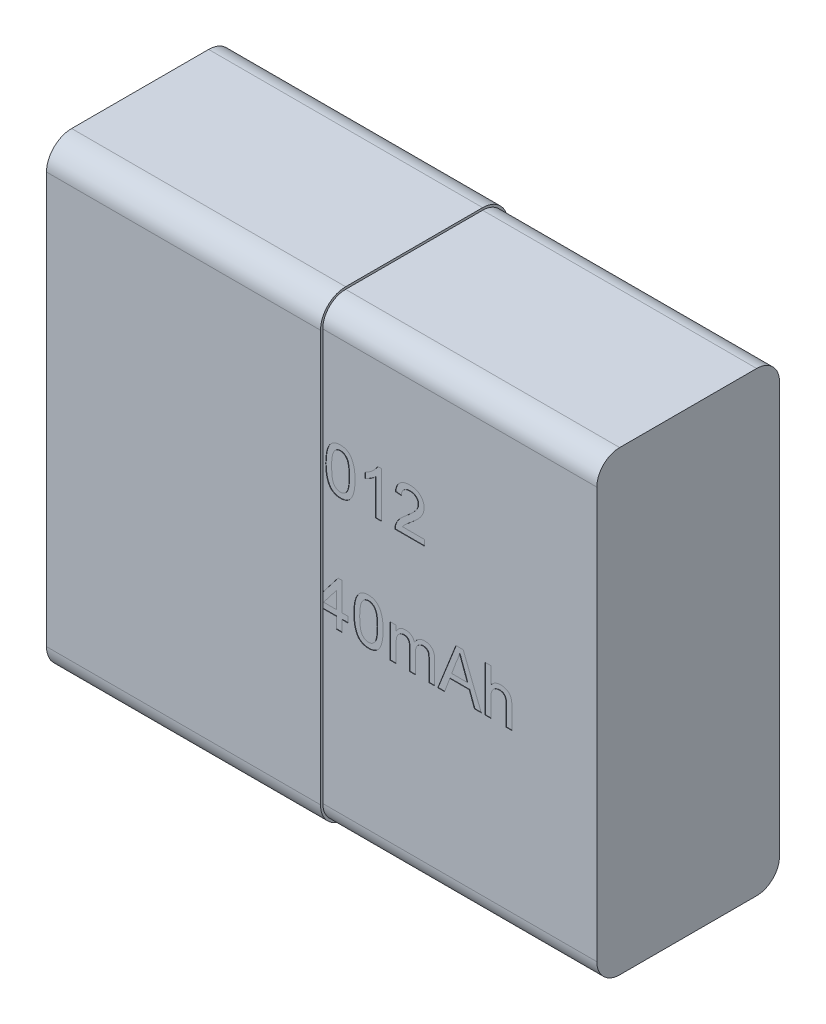
from build123d import *

# Parameters (mm, degrees)
SKETCH1_W           = 12
SKETCH1_H           = 10
BOSS_EXTRUDE1_DEPTH = 4
FILLET1_R           = 0.5
BOSS_EXTRUDE2_DEPTH = 6
SKETCH5_W           = 0.128205128
SKETCH5_H           = 0.128205129
SKETCH5_W_2         = 0.371794872
SKETCH5_H_2         = 0.115384616
CUT_EXTRUDE1_DEPTH  = 0.01


with BuildPart() as part:
    # Sketch1 → Boss-Extrude1 (new body)
    with BuildSketch(Plane.XY):
        Rectangle(SKETCH1_W, SKETCH1_H)
    extrude(amount=BOSS_EXTRUDE1_DEPTH)

    # Fillet1
    fillet1_edges = [part.edges().sort_by_distance(p)[0] for p in [
        (0, 5, 4),
        (0, 5, 0),
        (0, -5, 0),
        (0, -5, 4),
    ]]
    fillet(fillet1_edges, radius=FILLET1_R)

    # Sketch5 → Cut-Extrude1 (cut)
    # profile 1 of 16: a face of its own
    with BuildSketch(Plane.XY.offset(4)):
        with BuildLine():
            Line((-2.243589744, 1.762048705), (-2.115384615, 1.774869218))
            add(Edge.make_bspline(
                [(-2.115384615, 1.774869218), (-2.113675487, 1.767165894), (-2.110368452, 1.752260535), (-2.104005311, 1.730907059), (-2.097284437, 1.711086259), (-2.088952609, 1.693241478), (-2.080822556, 1.676642938), (-2.071268512, 1.661976476), (-2.061059831, 1.648859423), (-2.050007788, 1.637340487), (-2.037985028, 1.627421277), (-2.025151842, 1.618741433), (-2.011236819, 1.611492594), (-1.996346496, 1.605753281), (-1.980606285, 1.601107257), (-1.963930646, 1.597695767), (-1.946231402, 1.5956635), (-1.934100007, 1.59547739), (-1.927884615, 1.595382038)],
                knots=[0, 0, 0, 0, 1.321063709, 2.556160278, 3.730472002, 4.821700466, 5.852032229, 6.822994757, 7.746964065, 8.632786469, 9.490489437, 10.352773447, 11.223141997, 12.11199479, 13.021433979, 13.96892724, 14.959401504, 16, 16, 16, 16], degree=3))
            add(Edge.make_bspline(
                [(-1.927884615, 1.595382038), (-1.920594182, 1.595485982), (-1.906355954, 1.595688985), (-1.885608506, 1.5987348), (-1.865863651, 1.602916995), (-1.847403096, 1.609474915), (-1.829969786, 1.617489905), (-1.813663041, 1.627394734), (-1.798371242, 1.639025481), (-1.784396009, 1.65246126), (-1.771897992, 1.667241046), (-1.760766753, 1.682852271), (-1.751562713, 1.699428143), (-1.743805094, 1.716735184), (-1.738078956, 1.735053069), (-1.733886961, 1.754153383), (-1.73114747, 1.774122505), (-1.730897041, 1.787747329), (-1.730769231, 1.794700949)],
                knots=[0, 0, 0, 0, 1.111377895, 2.170522867, 3.193923215, 4.186422864, 5.152846954, 6.117443035, 7.091571248, 8.078879332, 9.069127402, 10.041602243, 10.999610288, 11.957618333, 12.930786866, 13.922135183, 14.939532534, 16, 16, 16, 16], degree=3))
            add(Edge.make_bspline(
                [(-1.730769231, 1.794700949), (-1.730919445, 1.80131838), (-1.731213328, 1.814264857), (-1.733629282, 1.833267507), (-1.737845069, 1.851306147), (-1.743689158, 1.868485174), (-1.751156703, 1.884779367), (-1.760132473, 1.900323465), (-1.771110575, 1.914776817), (-1.783467397, 1.928294665), (-1.796945085, 1.940748481), (-1.811694344, 1.951342055), (-1.827216108, 1.960484655), (-1.84369536, 1.967866946), (-1.861063678, 1.973726313), (-1.879304506, 1.977937555), (-1.89850554, 1.980354558), (-1.911585045, 1.980648492), (-1.918269231, 1.980798705)],
                knots=[0, 0, 0, 0, 1.072815875, 2.098878726, 3.09954706, 4.07199174, 5.036203424, 6.001873089, 6.97636515, 7.972747947, 8.969130744, 9.945905975, 10.911575641, 11.885646534, 12.868345115, 13.879560892, 14.916365174, 16, 16, 16, 16], degree=3))
            add(Edge.make_bspline(
                [(-1.918269231, 1.980798705), (-1.92415425, 1.980642792), (-1.936643633, 1.980311909), (-1.956356058, 1.977390337), (-1.978190909, 1.97329945), (-1.993279413, 1.969284852), (-2.001201923, 1.96717691)],
                knots=[0, 0, 0, 0, 0.837610211, 1.777604146, 2.833088267, 4, 4, 4, 4], degree=3))
            Line((-2.001201923, 1.96717691), (-1.987980769, 2.082561526))
            add(Edge.make_bspline(
                [(-1.987980769, 2.082561526), (-1.984511848, 2.082182467), (-1.978383457, 2.081512802), (-1.972224162, 2.081266268), (-1.969551282, 2.081159282)],
                knots=[0, 0, 0, 0, 1.132082448, 2, 2, 2, 2], degree=3))
            add(Edge.make_bspline(
                [(-1.969551282, 2.081159282), (-1.957760656, 2.081609443), (-1.934631153, 2.082492519), (-1.900912822, 2.089830137), (-1.868957734, 2.101382979), (-1.844270364, 2.115167196), (-1.825963045, 2.128132001), (-1.814418817, 2.139821611), (-1.8040111, 2.152226649), (-1.796246093, 2.166455677), (-1.789537606, 2.181574363), (-1.78538339, 2.198178273), (-1.782353796, 2.215863807), (-1.782153931, 2.228113288), (-1.782051282, 2.234404474)],
                knots=[0, 0, 0, 0, 1.557468908, 3.055264441, 4.54122591, 6.035034992, 6.780215604, 7.498173296, 8.201377046, 8.913174237, 9.633083494, 10.382644491, 11.169345745, 12, 12, 12, 12], degree=3))
            add(Edge.make_bspline(
                [(-1.782051282, 2.234404474), (-1.782146019, 2.239486077), (-1.782331298, 2.249424259), (-1.784395392, 2.263994683), (-1.78780915, 2.277800608), (-1.792423183, 2.290989444), (-1.798470331, 2.30349207), (-1.80596927, 2.31529318), (-1.814537062, 2.32663217), (-1.824651037, 2.336923115), (-1.835482227, 2.346584783), (-1.847425601, 2.35472189), (-1.859912742, 2.361950512), (-1.873384046, 2.367412845), (-1.887506937, 2.371903774), (-1.902402138, 2.375050834), (-1.918075087, 2.377164296), (-1.928812184, 2.377342384), (-1.934294872, 2.37743332)],
                knots=[0, 0, 0, 0, 1.041493611, 2.036867705, 3.009952345, 3.954088258, 4.897230656, 5.850851638, 6.817653571, 7.805463921, 8.805067469, 9.788883576, 10.763797054, 11.758134544, 12.762883247, 13.799594994, 14.876406454, 16, 16, 16, 16], degree=3))
            add(Edge.make_bspline(
                [(-1.934294872, 2.37743332), (-1.945024353, 2.37701496), (-1.96574457, 2.376207045), (-1.995410033, 2.368732151), (-2.022292298, 2.3566368), (-2.042194631, 2.34245233), (-2.056327037, 2.328891175), (-2.065980219, 2.317396532), (-2.074614444, 2.304703093), (-2.082254182, 2.290815385), (-2.088796217, 2.275677554), (-2.094693681, 2.259477137), (-2.099258865, 2.241954764), (-2.10144368, 2.229813487), (-2.102564103, 2.223587167)],
                knots=[0, 0, 0, 0, 1.533565899, 2.961543033, 4.347411787, 5.731829577, 6.434842101, 7.147085226, 7.87612511, 8.629021686, 9.412189982, 10.234506416, 11.094615066, 12, 12, 12, 12], degree=3))
            Line((-2.102564103, 2.223587167), (-2.230769231, 2.236407679))
            add(Edge.make_bspline(
                [(-2.230769231, 2.236407679), (-2.22876372, 2.246320639), (-2.224829752, 2.265765691), (-2.21681498, 2.293849644), (-2.207041063, 2.320212478), (-2.195305834, 2.344733326), (-2.182163702, 2.367705643), (-2.167003299, 2.388856943), (-2.150180061, 2.408312973), (-2.131664106, 2.426014389), (-2.111706798, 2.441823733), (-2.090408658, 2.455461366), (-2.06794447, 2.467021226), (-2.044293203, 2.476340519), (-2.019473584, 2.483918515), (-1.993415, 2.488938957), (-1.966235403, 2.492335033), (-1.947727205, 2.492654988), (-1.938301282, 2.492817936)],
                knots=[0, 0, 0, 0, 1.136581168, 2.229493434, 3.279335563, 4.293305329, 5.282068175, 6.250623624, 7.213783178, 8.169396253, 9.125981663, 10.071280146, 11.007896369, 11.961295906, 12.925420184, 13.920544621, 14.940967302, 16, 16, 16, 16], degree=3))
            add(Edge.make_bspline(
                [(-1.938301282, 2.492817936), (-1.92525356, 2.49239483), (-1.899597521, 2.491562868), (-1.861914779, 2.484955324), (-1.825871434, 2.474112211), (-1.791757525, 2.459081724), (-1.760159964, 2.440714865), (-1.732198727, 2.418703303), (-1.708247618, 2.393427834), (-1.688771834, 2.365164791), (-1.673349745, 2.335073096), (-1.661937863, 2.303836611), (-1.655119092, 2.271491296), (-1.654271329, 2.249593525), (-1.653846154, 2.238611205)],
                knots=[0, 0, 0, 0, 1.104647871, 2.172094857, 3.229560912, 4.285649672, 5.322588163, 6.317201348, 7.289435229, 8.260615662, 9.214246199, 10.146367077, 11.070353327, 12, 12, 12, 12], degree=3))
            add(Edge.make_bspline(
                [(-1.653846154, 2.238611205), (-1.654277197, 2.228229652), (-1.655128271, 2.207731772), (-1.661680533, 2.177760241), (-1.672752552, 2.149365586), (-1.687717765, 2.122448182), (-1.707123975, 2.09759014), (-1.730917877, 2.07543936), (-1.758718834, 2.05578389), (-1.779553299, 2.045553435), (-1.790264423, 2.040293897)],
                knots=[0, 0, 0, 0, 0.975609618, 1.926294443, 2.868398979, 3.832526731, 4.812148358, 5.820404151, 6.879456693, 8, 8, 8, 8], degree=3))
            add(Edge.make_bspline(
                [(-1.790264423, 2.040293897), (-1.783083329, 2.038480813), (-1.769017663, 2.034929511), (-1.748816175, 2.027571312), (-1.729824509, 2.018956712), (-1.711789898, 2.009199664), (-1.695235919, 1.997660374), (-1.679591973, 1.985043468), (-1.665449436, 1.970741307), (-1.652398574, 1.955263646), (-1.640523892, 1.938772462), (-1.630531231, 1.920946963), (-1.621907855, 1.90225575), (-1.614554659, 1.882563258), (-1.60927067, 1.861717641), (-1.60549245, 1.839880391), (-1.602999133, 1.817127378), (-1.602710534, 1.801585231), (-1.602564103, 1.793699346)],
                knots=[0, 0, 0, 0, 1.053251915, 2.063013066, 3.05373318, 4.018979697, 4.975584284, 5.920798056, 6.874756953, 7.832116109, 8.799604348, 9.761196922, 10.734637845, 11.72654167, 12.747371341, 13.789206138, 14.878271633, 16, 16, 16, 16], degree=3))
            add(Edge.make_bspline(
                [(-1.602564103, 1.793699346), (-1.60280811, 1.782933216), (-1.603287664, 1.761774315), (-1.60783385, 1.730691407), (-1.615263338, 1.700909804), (-1.625544753, 1.67232837), (-1.638572933, 1.644830462), (-1.65492115, 1.61880412), (-1.674104879, 1.594037787), (-1.695824211, 1.57076859), (-1.719619818, 1.549383482), (-1.745460937, 1.530866023), (-1.772836303, 1.515140705), (-1.801790465, 1.502316786), (-1.832246666, 1.49224162), (-1.864235205, 1.485019419), (-1.897855068, 1.480774857), (-1.920794406, 1.480259978), (-1.932491987, 1.479997423)],
                knots=[0, 0, 0, 0, 1.016055063, 1.996874249, 2.958724482, 3.910019225, 4.860394196, 5.826121543, 6.806008102, 7.814207964, 8.82789325, 9.821757317, 10.810247154, 11.803791187, 12.806673825, 13.834534493, 14.895752369, 16, 16, 16, 16], degree=3))
            add(Edge.make_bspline(
                [(-1.932491987, 1.479997423), (-1.942989596, 1.480195155), (-1.96365582, 1.480584423), (-1.993906905, 1.484639929), (-2.022889018, 1.490395159), (-2.050372983, 1.499267537), (-2.076678051, 1.510087258), (-2.10135871, 1.523929459), (-2.124858737, 1.539819769), (-2.146736949, 1.55821218), (-2.166871843, 1.578512593), (-2.184834577, 1.600420749), (-2.200259299, 1.623888004), (-2.213859215, 1.648563245), (-2.224851465, 1.674911611), (-2.233410671, 1.702706884), (-2.239937181, 1.731845909), (-2.242358976, 1.751871565), (-2.243589744, 1.762048705)],
                knots=[0, 0, 0, 0, 1.08471039, 2.135426191, 3.150939737, 4.135689946, 5.116584603, 6.086901885, 7.055842759, 8.045878862, 9.036901429, 10.008421467, 10.96965771, 11.936653536, 12.917548193, 13.915472582, 14.940632654, 16, 16, 16, 16], degree=3))
        make_face()
    # profile 2 of 16: a face of its own
    with BuildSketch(Plane.XY.offset(4)):
        with BuildLine():
            add(Edge.make_bspline(
                [(-1.474358974, 1.986007038), (-1.474229808, 2.000297956), (-1.473976825, 2.028287846), (-1.472407652, 2.069242084), (-1.469668004, 2.108134627), (-1.465578464, 2.144931701), (-1.460735683, 2.179716362), (-1.454440036, 2.21243897), (-1.447356519, 2.243172943), (-1.438857569, 2.271886246), (-1.429520005, 2.298825761), (-1.418926242, 2.32394827), (-1.40700682, 2.34722714), (-1.394347507, 2.368903783), (-1.380281889, 2.388641039), (-1.365658939, 2.406992817), (-1.349415949, 2.423286085), (-1.332228337, 2.43794007), (-1.31384301, 2.450871357), (-1.294357246, 2.462029499), (-1.273846021, 2.471881334), (-1.251918413, 2.479297792), (-1.229029634, 2.485343778), (-1.2050035, 2.489791278), (-1.179813533, 2.49241323), (-1.162599732, 2.49268151), (-1.153846154, 2.492817936)],
                knots=[0, 0, 0, 0, 1.514747001, 2.966751498, 4.343369068, 5.64627492, 6.890416844, 8.064737671, 9.177176366, 10.232018008, 11.237056675, 12.19799043, 13.119080079, 14.007588942, 14.855863561, 15.685992447, 16.491747269, 17.290132607, 18.077525251, 18.870243746, 19.668095604, 20.485086593, 21.319398728, 22.175900658, 23.072407314, 24, 24, 24, 24], degree=3))
            add(Edge.make_bspline(
                [(-1.153846154, 2.492817936), (-1.141003516, 2.492440371), (-1.115773639, 2.491698631), (-1.078937889, 2.48564913), (-1.044222568, 2.475300526), (-1.011650231, 2.461339812), (-0.981777698, 2.443607019), (-0.955100266, 2.422050108), (-0.931905696, 2.396895421), (-0.912447119, 2.367844885), (-0.895438381, 2.335699906), (-0.880328192, 2.300316206), (-0.866669019, 2.261733438), (-0.856976173, 2.227196473), (-0.850062274, 2.19738294), (-0.845485822, 2.172793581), (-0.84168645, 2.146261525), (-0.838775617, 2.117850959), (-0.836387347, 2.087593748), (-0.834542996, 2.055471054), (-0.833606799, 2.021402592), (-0.833426197, 1.99802674), (-0.833333333, 1.986007038)],
                knots=[0, 0, 0, 0, 1.134486744, 2.228744715, 3.287356444, 4.328707449, 5.352829806, 6.347195599, 7.349461267, 8.364207941, 9.428085653, 10.559314403, 11.761222316, 13.04268526, 13.726896727, 14.465273606, 15.252205015, 16.094778733, 16.988606776, 17.934225168, 18.937792761, 20, 20, 20, 20], degree=3))
            add(Edge.make_bspline(
                [(-0.833333333, 1.986007038), (-0.83346492, 1.971783247), (-0.833721999, 1.943994271), (-0.835249125, 1.903368417), (-0.838153856, 1.864769299), (-0.84172818, 1.828108497), (-0.847135384, 1.793483877), (-0.852961939, 1.76074833), (-0.860167949, 1.730050503), (-0.86857567, 1.701376943), (-0.878044674, 1.674576033), (-0.888428901, 1.649445227), (-0.89993043, 1.626001699), (-0.91289159, 1.604474103), (-0.926719348, 1.584576698), (-0.941514979, 1.566234843), (-0.957592167, 1.549712531), (-0.974934666, 1.5351025), (-0.993190905, 1.521941895), (-1.012724042, 1.510673588), (-1.033448585, 1.501337992), (-1.055226065, 1.493356522), (-1.078277446, 1.487508168), (-1.102420946, 1.483031345), (-1.127745524, 1.480395067), (-1.145025907, 1.4801318), (-1.153846154, 1.479997423)],
                knots=[0, 0, 0, 0, 1.508974709, 2.94807912, 4.311757619, 5.615040294, 6.854280449, 8.028314546, 9.141715822, 10.197470207, 11.196696834, 12.155719058, 13.080757287, 13.963948316, 14.818758719, 15.649605906, 16.461113142, 17.260189315, 18.052359509, 18.845763934, 19.647754795, 20.461145776, 21.303032214, 22.167241874, 23.064524267, 24, 24, 24, 24], degree=3))
            add(Edge.make_bspline(
                [(-1.153846154, 1.479997423), (-1.16541052, 1.480327297), (-1.187957851, 1.480970461), (-1.220886565, 1.485340363), (-1.25179192, 1.493031595), (-1.280934584, 1.503346623), (-1.307986986, 1.517143566), (-1.33307829, 1.533930241), (-1.356712689, 1.553316089), (-1.370318085, 1.568611078), (-1.377203526, 1.57635159)],
                knots=[0, 0, 0, 0, 1.10322584, 2.150986741, 3.161425019, 4.136713905, 5.093944212, 6.049774532, 7.013026876, 8, 8, 8, 8], degree=3))
            add(Edge.make_bspline(
                [(-1.377203526, 1.57635159), (-1.385128826, 1.587783951), (-1.401471134, 1.61135797), (-1.420598388, 1.651553859), (-1.437660238, 1.695803889), (-1.451050661, 1.744976241), (-1.461538701, 1.798679558), (-1.469113684, 1.857019217), (-1.473400379, 1.919970015), (-1.474032229, 1.963497781), (-1.474358974, 1.986007038)],
                knots=[0, 0, 0, 0, 0.779365345, 1.607084704, 2.489375761, 3.438383567, 4.461919411, 5.557722155, 6.737039282, 8, 8, 8, 8], degree=3))
        make_face()
        with BuildLine():
            add(Edge.make_bspline(
                [(-1.346153846, 1.986407679), (-1.346026549, 1.967174042), (-1.345782873, 1.930356606), (-1.343237055, 1.877756547), (-1.338854534, 1.830304113), (-1.333060554, 1.788065007), (-1.325410156, 1.75098209), (-1.315804176, 1.719149863), (-1.304975951, 1.692186265), (-1.291576228, 1.67042549), (-1.276905012, 1.652687284), (-1.261757984, 1.637431853), (-1.245778787, 1.624465087), (-1.229071683, 1.613653447), (-1.21137745, 1.605467585), (-1.19288957, 1.599534453), (-1.173604022, 1.596120027), (-1.160469687, 1.595629438), (-1.153846154, 1.595382038)],
                knots=[0, 0, 0, 0, 1.89448813, 3.626469325, 5.185477471, 6.587276848, 7.82441448, 8.910550357, 9.859733512, 10.6775885, 11.416198291, 12.123144072, 12.791880183, 13.439617036, 14.078171869, 14.70637855, 15.347637704, 16, 16, 16, 16], degree=3))
            add(Edge.make_bspline(
                [(-1.153846154, 1.595382038), (-1.147224279, 1.595634844), (-1.134093233, 1.596136152), (-1.114763124, 1.599475287), (-1.096347177, 1.605713852), (-1.078679325, 1.613870802), (-1.061850789, 1.624436012), (-1.045950071, 1.637451757), (-1.030723251, 1.652698129), (-1.016117938, 1.67064251), (-1.002820302, 1.692503892), (-0.991788953, 1.719445525), (-0.982332677, 1.7513335), (-0.974640299, 1.788397523), (-0.968822419, 1.830569847), (-0.964466395, 1.877890669), (-0.96190354, 1.930423049), (-0.961663885, 1.967173955), (-0.961538462, 1.986407679)],
                knots=[0, 0, 0, 0, 0.652509534, 1.29391342, 1.924290653, 2.562989607, 3.207355802, 3.876242846, 4.583348185, 5.32723334, 6.150888545, 7.094226006, 8.186903555, 9.424320409, 10.81992305, 12.379283064, 14.105084285, 16, 16, 16, 16], degree=3))
            add(Edge.make_bspline(
                [(-0.961538462, 1.986407679), (-0.96165987, 2.005241212), (-0.961892483, 2.041325547), (-0.964521438, 2.092912265), (-0.968641246, 2.139568229), (-0.97427649, 2.181336451), (-0.981765728, 2.218171586), (-0.990849152, 2.250152052), (-1.00167341, 2.277209644), (-1.014543414, 2.299616156), (-1.028870304, 2.317995575), (-1.043836099, 2.333904562), (-1.059814944, 2.347434637), (-1.077089938, 2.358288662), (-1.095104274, 2.367045286), (-1.114271877, 2.373071818), (-1.134404344, 2.37677433), (-1.148220994, 2.377211147), (-1.155248397, 2.37743332)],
                knots=[0, 0, 0, 0, 1.850066095, 3.544656626, 5.0727657, 6.45041401, 7.682899467, 8.762389858, 9.712573485, 10.538438529, 11.291566246, 11.996865408, 12.681389046, 13.341983376, 13.996294293, 14.643563182, 15.31009126, 16, 16, 16, 16], degree=3))
            add(Edge.make_bspline(
                [(-1.155248397, 2.37743332), (-1.161871515, 2.37725949), (-1.174931453, 2.376916718), (-1.194052914, 2.373644964), (-1.212174097, 2.368173863), (-1.229502614, 2.360762725), (-1.245605867, 2.350788796), (-1.26112247, 2.339143525), (-1.275325687, 2.324955063), (-1.283884421, 2.314347989), (-1.288261218, 2.308923705)],
                knots=[0, 0, 0, 0, 1.021318143, 2.013908504, 2.982026795, 3.937174072, 4.91255697, 5.897578595, 6.924855925, 8, 8, 8, 8], degree=3))
            add(Edge.make_bspline(
                [(-1.288261218, 2.308923705), (-1.293026215, 2.300957111), (-1.303088885, 2.284133342), (-1.314348428, 2.254892939), (-1.324294662, 2.221476724), (-1.332483711, 2.183370564), (-1.338407914, 2.140639826), (-1.343084843, 2.093334136), (-1.345514333, 2.041387447), (-1.345934794, 2.005239905), (-1.346153846, 1.986407679)],
                knots=[0, 0, 0, 0, 0.671104906, 1.417232262, 2.260109084, 3.195198885, 4.23592645, 5.382417421, 6.636286093, 8, 8, 8, 8], degree=3))
        make_face(mode=Mode.SUBTRACT)
    # profile 3 of 16: a face of its own
    with BuildSketch(Plane.XY.offset(4)):
        with BuildLine():
            Line((-0.256410256, 1.492817936), (-0.384615385, 1.492817936))
            Line((-0.384615385, 1.492817936), (-0.384615385, 2.272064731))
            add(Edge.make_bspline(
                [(-0.384615385, 2.272064731), (-0.391997447, 2.264945639), (-0.407340255, 2.250149389), (-0.433275652, 2.229208999), (-0.462222869, 2.207985026), (-0.493806008, 2.187575804), (-0.525999676, 2.168362722), (-0.557110711, 2.151083509), (-0.586619701, 2.136461102), (-0.606057432, 2.128465512), (-0.615384615, 2.124628833)],
                knots=[0, 0, 0, 0, 0.893362401, 1.856755847, 2.901947673, 4.020460078, 5.132200827, 6.168787962, 7.121294059, 8, 8, 8, 8], degree=3))
            Line((-0.615384615, 2.124628833), (-0.615384615, 2.242817936))
            add(Edge.make_bspline(
                [(-0.615384615, 2.242817936), (-0.599364215, 2.251068474), (-0.567788953, 2.267329797), (-0.523179936, 2.295415337), (-0.481532621, 2.325861219), (-0.443536434, 2.358660701), (-0.409475273, 2.39218766), (-0.380771439, 2.426017679), (-0.356753897, 2.458910694), (-0.344703841, 2.481849925), (-0.338942308, 2.492817936)],
                knots=[0, 0, 0, 0, 1.141258006, 2.249351951, 3.335817539, 4.406819942, 5.426913362, 6.360259544, 7.215985427, 8, 8, 8, 8], degree=3))
            Line((-0.338942308, 2.492817936), (-0.256410256, 2.492817936))
            Line((-0.256410256, 2.492817936), (-0.256410256, 1.492817936))
        make_face()
    # profile 4 of 16: a face of its own
    with BuildSketch(Plane.XY.offset(4)):
        with BuildLine():
            add(Edge.make_bspline(
                [(0.064102564, 1.986007038), (0.064231731, 2.000297956), (0.064484714, 2.028287846), (0.066053886, 2.069242084), (0.068793534, 2.108134627), (0.072883074, 2.144931701), (0.077725856, 2.179716362), (0.084021502, 2.21243897), (0.09110502, 2.243172943), (0.099603969, 2.271886246), (0.108941533, 2.298825761), (0.119535297, 2.32394827), (0.131454718, 2.34722714), (0.144114032, 2.368903783), (0.15817965, 2.388641039), (0.172802599, 2.406992817), (0.189045589, 2.423286085), (0.206233202, 2.43794007), (0.224618528, 2.450871357), (0.244104292, 2.462029499), (0.264615518, 2.471881334), (0.286543126, 2.479297792), (0.309431904, 2.485343778), (0.333458039, 2.489791278), (0.358648005, 2.49241323), (0.375861806, 2.49268151), (0.384615385, 2.492817936)],
                knots=[0, 0, 0, 0, 1.514747001, 2.966751498, 4.343369068, 5.64627492, 6.890416844, 8.064737671, 9.177176366, 10.232018008, 11.237056675, 12.19799043, 13.119080079, 14.007588942, 14.855863561, 15.685992447, 16.491747269, 17.290132607, 18.077525251, 18.870243746, 19.668095604, 20.485086593, 21.319398728, 22.175900658, 23.072407314, 24, 24, 24, 24], degree=3))
            add(Edge.make_bspline(
                [(0.384615385, 2.492817936), (0.397458022, 2.492440371), (0.422687899, 2.491698631), (0.45952365, 2.48564913), (0.494238971, 2.475300526), (0.526811307, 2.461339812), (0.556683841, 2.443607019), (0.583361273, 2.422050108), (0.606555843, 2.396895421), (0.626014419, 2.367844885), (0.643023157, 2.335699906), (0.658133347, 2.300316206), (0.671792519, 2.261733438), (0.681485365, 2.227196473), (0.688399264, 2.19738294), (0.692975716, 2.172793581), (0.696775089, 2.146261525), (0.699685922, 2.117850959), (0.702074191, 2.087593748), (0.703918543, 2.055471054), (0.70485474, 2.021402592), (0.705035341, 1.99802674), (0.705128205, 1.986007038)],
                knots=[0, 0, 0, 0, 1.134486744, 2.228744715, 3.287356444, 4.328707449, 5.352829806, 6.347195599, 7.349461267, 8.364207941, 9.428085653, 10.559314403, 11.761222316, 13.04268526, 13.726896727, 14.465273606, 15.252205015, 16.094778733, 16.988606776, 17.934225168, 18.937792761, 20, 20, 20, 20], degree=3))
            add(Edge.make_bspline(
                [(0.705128205, 1.986007038), (0.704996619, 1.971783247), (0.704739539, 1.943994271), (0.703212414, 1.903368417), (0.700307683, 1.864769299), (0.696733359, 1.828108497), (0.691326155, 1.793483877), (0.685499599, 1.76074833), (0.67829359, 1.730050503), (0.669885868, 1.701376943), (0.660416865, 1.674576033), (0.650032637, 1.649445227), (0.638531108, 1.626001699), (0.625569948, 1.604474103), (0.61174219, 1.584576698), (0.596946559, 1.566234843), (0.580869371, 1.549712531), (0.563526872, 1.5351025), (0.545270634, 1.521941895), (0.525737496, 1.510673588), (0.505012953, 1.501337992), (0.483235474, 1.493356522), (0.460184093, 1.487508168), (0.436040592, 1.483031345), (0.410716014, 1.480395067), (0.393435631, 1.4801318), (0.384615385, 1.479997423)],
                knots=[0, 0, 0, 0, 1.508974709, 2.94807912, 4.311757619, 5.615040294, 6.854280449, 8.028314546, 9.141715822, 10.197470207, 11.196696834, 12.155719058, 13.080757287, 13.963948316, 14.818758719, 15.649605906, 16.461113142, 17.260189315, 18.052359509, 18.845763934, 19.647754795, 20.461145776, 21.303032214, 22.167241874, 23.064524267, 24, 24, 24, 24], degree=3))
            add(Edge.make_bspline(
                [(0.384615385, 1.479997423), (0.373051019, 1.480327297), (0.350503688, 1.480970461), (0.317574973, 1.485340363), (0.286669619, 1.493031595), (0.257526955, 1.503346623), (0.230474553, 1.517143566), (0.205383248, 1.533930241), (0.18174885, 1.553316089), (0.168143453, 1.568611078), (0.161258013, 1.57635159)],
                knots=[0, 0, 0, 0, 1.10322584, 2.150986741, 3.161425019, 4.136713905, 5.093944212, 6.049774532, 7.013026876, 8, 8, 8, 8], degree=3))
            add(Edge.make_bspline(
                [(0.161258013, 1.57635159), (0.153332713, 1.587783951), (0.136990405, 1.61135797), (0.11786315, 1.651553859), (0.100801301, 1.695803889), (0.087410877, 1.744976241), (0.076922837, 1.798679558), (0.069347854, 1.857019217), (0.065061159, 1.919970015), (0.064429309, 1.963497781), (0.064102564, 1.986007038)],
                knots=[0, 0, 0, 0, 0.779365345, 1.607084704, 2.489375761, 3.438383567, 4.461919411, 5.557722155, 6.737039282, 8, 8, 8, 8], degree=3))
        make_face()
        with BuildLine():
            add(Edge.make_bspline(
                [(0.192307692, 1.986407679), (0.19243499, 1.967174042), (0.192678665, 1.930356606), (0.195224484, 1.877756547), (0.199607005, 1.830304113), (0.205400984, 1.788065007), (0.213051383, 1.75098209), (0.222657363, 1.719149863), (0.233485587, 1.692186265), (0.24688531, 1.67042549), (0.261556526, 1.652687284), (0.276703554, 1.637431853), (0.292682752, 1.624465087), (0.309389856, 1.613653447), (0.327084089, 1.605467585), (0.345571968, 1.599534453), (0.364857517, 1.596120027), (0.377991851, 1.595629438), (0.384615385, 1.595382038)],
                knots=[0, 0, 0, 0, 1.89448813, 3.626469325, 5.185477471, 6.587276848, 7.82441448, 8.910550357, 9.859733512, 10.6775885, 11.416198291, 12.123144072, 12.791880183, 13.439617036, 14.078171869, 14.70637855, 15.347637704, 16, 16, 16, 16], degree=3))
            add(Edge.make_bspline(
                [(0.384615385, 1.595382038), (0.391237259, 1.595634844), (0.404368305, 1.596136152), (0.423698414, 1.599475287), (0.442114362, 1.605713852), (0.459782213, 1.613870802), (0.476610749, 1.624436012), (0.492511468, 1.637451757), (0.507738287, 1.652698129), (0.522343601, 1.67064251), (0.535641236, 1.692503892), (0.546672585, 1.719445525), (0.556128861, 1.7513335), (0.563821239, 1.788397523), (0.56963912, 1.830569847), (0.573995144, 1.877890669), (0.576557999, 1.930423049), (0.576797653, 1.967173955), (0.576923077, 1.986407679)],
                knots=[0, 0, 0, 0, 0.652509534, 1.29391342, 1.924290653, 2.562989607, 3.207355802, 3.876242846, 4.583348185, 5.32723334, 6.150888545, 7.094226006, 8.186903555, 9.424320409, 10.81992305, 12.379283064, 14.105084285, 16, 16, 16, 16], degree=3))
            add(Edge.make_bspline(
                [(0.576923077, 1.986407679), (0.576801669, 2.005241212), (0.576569056, 2.041325547), (0.573940101, 2.092912265), (0.569820292, 2.139568229), (0.564185048, 2.181336451), (0.55669581, 2.218171586), (0.547612386, 2.250152052), (0.536788128, 2.277209644), (0.523918124, 2.299616156), (0.509591234, 2.317995575), (0.49462544, 2.333904562), (0.478646594, 2.347434637), (0.461371601, 2.358288662), (0.443357264, 2.367045286), (0.424189661, 2.373071818), (0.404057195, 2.37677433), (0.390240544, 2.377211147), (0.383213141, 2.37743332)],
                knots=[0, 0, 0, 0, 1.850066095, 3.544656626, 5.0727657, 6.45041401, 7.682899467, 8.762389858, 9.712573485, 10.538438529, 11.291566246, 11.996865408, 12.681389046, 13.341983376, 13.996294293, 14.643563182, 15.31009126, 16, 16, 16, 16], degree=3))
            add(Edge.make_bspline(
                [(0.383213141, 2.37743332), (0.376590024, 2.37725949), (0.363530085, 2.376916718), (0.344408625, 2.373644964), (0.326287441, 2.368173863), (0.308958925, 2.360762725), (0.292855672, 2.350788796), (0.277339068, 2.339143525), (0.263135852, 2.324955063), (0.254577118, 2.314347989), (0.250200321, 2.308923705)],
                knots=[0, 0, 0, 0, 1.021318143, 2.013908504, 2.982026795, 3.937174072, 4.91255697, 5.897578595, 6.924855925, 8, 8, 8, 8], degree=3))
            add(Edge.make_bspline(
                [(0.250200321, 2.308923705), (0.245435324, 2.300957111), (0.235372654, 2.284133342), (0.224113111, 2.254892939), (0.214166876, 2.221476724), (0.205977827, 2.183370564), (0.200053625, 2.140639826), (0.195376696, 2.093334136), (0.192947206, 2.041387447), (0.192526745, 2.005239905), (0.192307692, 1.986407679)],
                knots=[0, 0, 0, 0, 0.671104906, 1.417232262, 2.260109084, 3.195198885, 4.23592645, 5.382417421, 6.636286093, 8, 8, 8, 8], degree=3))
        make_face(mode=Mode.SUBTRACT)
    # profile 5 of 16: a face of its own
    with BuildSketch(Plane.XY.offset(4)):
        with BuildLine():
            Line((1.282051282, 1.492817936), (1.153846154, 1.492817936))
            Line((1.153846154, 1.492817936), (1.153846154, 2.272064731))
            add(Edge.make_bspline(
                [(1.153846154, 2.272064731), (1.146464091, 2.264945639), (1.131121283, 2.250149389), (1.105185887, 2.229208999), (1.07623867, 2.207985026), (1.04465553, 2.187575804), (1.012461863, 2.168362722), (0.981350828, 2.151083509), (0.951841837, 2.136461102), (0.932404106, 2.128465512), (0.923076923, 2.124628833)],
                knots=[0, 0, 0, 0, 0.893362401, 1.856755847, 2.901947673, 4.020460078, 5.132200827, 6.168787962, 7.121294059, 8, 8, 8, 8], degree=3))
            Line((0.923076923, 2.124628833), (0.923076923, 2.242817936))
            add(Edge.make_bspline(
                [(0.923076923, 2.242817936), (0.939097324, 2.251068474), (0.970672585, 2.267329797), (1.015281602, 2.295415337), (1.056928918, 2.325861219), (1.094925105, 2.358660701), (1.128986265, 2.39218766), (1.157690099, 2.426017679), (1.181707642, 2.458910694), (1.193757697, 2.481849925), (1.199519231, 2.492817936)],
                knots=[0, 0, 0, 0, 1.141258006, 2.249351951, 3.335817539, 4.406819942, 5.426913362, 6.360259544, 7.215985427, 8, 8, 8, 8], degree=3))
            Line((1.199519231, 2.492817936), (1.282051282, 2.492817936))
            Line((1.282051282, 2.492817936), (1.282051282, 1.492817936))
        make_face()
    # profile 6 of 16: a face of its own
    with BuildSketch(Plane.XY.offset(4)):
        with BuildLine():
            Line((2.230769231, 1.621023064), (2.230769231, 1.492817936))
            Line((2.230769231, 1.492817936), (1.576923077, 1.492817936))
            add(Edge.make_bspline(
                [(1.576923077, 1.492817936), (1.576909691, 1.500437527), (1.576882964, 1.51565117), (1.579457357, 1.538151184), (1.583489373, 1.560352715), (1.588048372, 1.574589675), (1.590344551, 1.581760243)],
                knots=[0, 0, 0, 0, 1.01057331, 2.01775941, 3.001627217, 4, 4, 4, 4], degree=3))
            add(Edge.make_bspline(
                [(1.590344551, 1.581760243), (1.594587127, 1.593476098), (1.60322571, 1.617331506), (1.62072757, 1.651751529), (1.641313893, 1.685963387), (1.661357576, 1.713816669), (1.679713261, 1.736069494), (1.695106896, 1.753479755), (1.712165866, 1.771301208), (1.730876508, 1.789530598), (1.751058745, 1.808285991), (1.772740114, 1.827629934), (1.796176639, 1.847201931), (1.812537786, 1.860175066), (1.820913462, 1.866816333)],
                knots=[0, 0, 0, 0, 1.204657718, 2.452881516, 3.728232997, 5.065887527, 5.768225529, 6.518857853, 7.313994055, 8.154655305, 9.046094665, 9.979688118, 10.965752482, 12, 12, 12, 12], degree=3))
            add(Edge.make_bspline(
                [(1.820913462, 1.866816333), (1.833780567, 1.877646367), (1.858556996, 1.898500285), (1.893545196, 1.929445566), (1.925501221, 1.958180012), (1.953916208, 1.985207254), (1.979022562, 2.010265144), (2.000879234, 2.03329691), (2.019674284, 2.054230675), (2.035178262, 2.073824153), (2.048259443, 2.092325846), (2.05934459, 2.110373105), (2.068582588, 2.128281175), (2.076276605, 2.145993392), (2.082361919, 2.163585501), (2.086509925, 2.181108754), (2.08932296, 2.19838928), (2.089604406, 2.209887933), (2.08974359, 2.215574346)],
                knots=[0, 0, 0, 0, 1.782554561, 3.432421876, 4.950675607, 6.337395053, 7.588547463, 8.709982106, 9.702713005, 10.569305638, 11.356701089, 12.103210377, 12.812277205, 13.490692607, 14.148717897, 14.782152033, 15.397739362, 16, 16, 16, 16], degree=3))
            add(Edge.make_bspline(
                [(2.08974359, 2.215574346), (2.08960439, 2.221194411), (2.089331287, 2.232220673), (2.0867401, 2.248357539), (2.08313296, 2.263897726), (2.077301313, 2.278561478), (2.070359897, 2.292783044), (2.061455856, 2.306113041), (2.051155711, 2.318883688), (2.039362917, 2.330758282), (2.026482424, 2.341898547), (2.012090308, 2.351158813), (1.997131841, 2.359495812), (1.981090966, 2.366199237), (1.963993751, 2.371121682), (1.945964654, 2.374694109), (1.927006536, 2.376959219), (1.914068953, 2.377272891), (1.907451923, 2.37743332)],
                knots=[0, 0, 0, 0, 0.988194508, 1.938783882, 2.870742509, 3.789494954, 4.709148727, 5.651055405, 6.603531303, 7.592354411, 8.592907906, 9.593461401, 10.59787167, 11.603930315, 12.645063138, 13.723588815, 14.835711238, 16, 16, 16, 16], degree=3))
            add(Edge.make_bspline(
                [(1.907451923, 2.37743332), (1.900500917, 2.377273685), (1.886897286, 2.376961267), (1.867012421, 2.374687123), (1.848135189, 2.371212539), (1.830310646, 2.365900196), (1.813560488, 2.359207949), (1.797952933, 2.350784193), (1.783238041, 2.341275295), (1.769879239, 2.330017478), (1.757799049, 2.317534855), (1.747074653, 2.303945054), (1.738287622, 2.288985821), (1.73103093, 2.272986075), (1.725195941, 2.25589552), (1.720959938, 2.237583501), (1.718650441, 2.218102892), (1.718186021, 2.204762577), (1.717948718, 2.197946141)],
                knots=[0, 0, 0, 0, 1.131143733, 2.213731411, 3.253917892, 4.251203413, 5.236093891, 6.184197493, 7.13373276, 8.082770301, 9.020476205, 9.957489029, 10.893177274, 11.836722509, 12.812818608, 13.827831385, 14.890097571, 16, 16, 16, 16], degree=3))
            Line((1.717948718, 2.197946141), (1.58974359, 2.210766654))
            add(Edge.make_bspline(
                [(1.58974359, 2.210766654), (1.59105531, 2.221940044), (1.59360715, 2.243676913), (1.599963434, 2.275159106), (1.608887082, 2.30444657), (1.619564979, 2.331947634), (1.63295073, 2.357194146), (1.648082169, 2.380708302), (1.665929003, 2.401744333), (1.685645019, 2.420965323), (1.707446229, 2.437904073), (1.731127843, 2.452702423), (1.756679029, 2.465080329), (1.783957476, 2.475328719), (1.813025808, 2.48310443), (1.843842903, 2.488680349), (1.876458321, 2.492117409), (1.898829633, 2.492581095), (1.91025641, 2.492817936)],
                knots=[0, 0, 0, 0, 1.130804643, 2.199883102, 3.223565206, 4.205909148, 5.160801384, 6.091796021, 7.01151579, 7.927798993, 8.855738875, 9.7815393, 10.730299821, 11.705391175, 12.706931101, 13.751121791, 14.851322166, 16, 16, 16, 16], degree=3))
            add(Edge.make_bspline(
                [(1.91025641, 2.492817936), (1.92181996, 2.492619923), (1.944345822, 2.492234193), (1.977169624, 2.488287402), (2.008139789, 2.482140312), (2.037369851, 2.473573149), (2.064687117, 2.462339045), (2.090112598, 2.448613505), (2.113763528, 2.43253042), (2.135244746, 2.413896722), (2.154614923, 2.39355492), (2.171590026, 2.371845831), (2.185782029, 2.348862198), (2.197865639, 2.324917304), (2.206828499, 2.299505208), (2.213131347, 2.272971393), (2.217414315, 2.245293185), (2.217768215, 2.22640828), (2.217948718, 2.216776269)],
                knots=[0, 0, 0, 0, 1.195390245, 2.328627238, 3.413424916, 4.457841177, 5.473507151, 6.462241215, 7.441013641, 8.425227782, 9.397253344, 10.342087291, 11.269524934, 12.186751184, 13.110685745, 14.048630397, 15.004728144, 16, 16, 16, 16], degree=3))
            add(Edge.make_bspline(
                [(2.217948718, 2.216776269), (2.217673093, 2.206880469), (2.217121236, 2.18706703), (2.212813914, 2.157451782), (2.20544404, 2.128157926), (2.195673552, 2.098828937), (2.182325033, 2.06934841), (2.165461446, 2.03930966), (2.144540324, 2.008601728), (2.12442007, 1.982496573), (2.105691379, 1.960613871), (2.089090165, 1.942603128), (2.06988352, 1.923467919), (2.048791959, 1.902545546), (2.024955266, 1.880578588), (1.999058324, 1.856909232), (1.970534238, 1.832160365), (1.950732963, 1.815253127), (1.940504808, 1.806519859)],
                knots=[0, 0, 0, 0, 0.927118007, 1.856282007, 2.79721255, 3.754929441, 4.749232485, 5.824981375, 6.979078785, 8.228161913, 8.911614355, 9.677694854, 10.522803217, 11.452009355, 12.461436787, 13.560019032, 14.739651695, 16, 16, 16, 16], degree=3))
            add(Edge.make_bspline(
                [(1.940504808, 1.806519859), (1.931745938, 1.799389205), (1.915044121, 1.785792146), (1.891282552, 1.766080125), (1.869999413, 1.748004736), (1.850697001, 1.732155564), (1.834078299, 1.717766004), (1.819557934, 1.705466256), (1.807663441, 1.694637893), (1.789550234, 1.678189391), (1.766608312, 1.654743715), (1.749703722, 1.631962206), (1.741586538, 1.621023064)],
                knots=[0, 0, 0, 0, 1.241996727, 2.368296581, 3.394949853, 4.3125351, 5.114548721, 5.812230366, 6.404953749, 6.883082049, 8.503329734, 10, 10, 10, 10], degree=3))
            Line((1.741586538, 1.621023064), (2.230769231, 1.621023064))
        make_face()
    # profile 7 of 16: a face of its own
    with BuildSketch(Plane.XY.offset(4)):
        with BuildLine():
            Line((-4.166666667, -0.776412833), (-4.038461538, -0.763592321))
            add(Edge.make_bspline(
                [(-4.038461538, -0.763592321), (-4.036752411, -0.771295644), (-4.033445375, -0.786201003), (-4.027082234, -0.807554479), (-4.02036136, -0.827375279), (-4.012029532, -0.845220061), (-4.003899479, -0.861818601), (-3.994345435, -0.876485063), (-3.984136754, -0.889602115), (-3.973084711, -0.901121051), (-3.961061951, -0.911040262), (-3.948228765, -0.919720106), (-3.934313742, -0.926968944), (-3.919423419, -0.932708258), (-3.903683208, -0.937354281), (-3.88700757, -0.940765772), (-3.869308325, -0.942798039), (-3.85717693, -0.942984149), (-3.850961538, -0.9430795)],
                knots=[0, 0, 0, 0, 1.321063709, 2.556160278, 3.730472002, 4.821700466, 5.852032229, 6.822994757, 7.746964065, 8.632786469, 9.490489437, 10.352773447, 11.223141997, 12.11199479, 13.021433979, 13.96892724, 14.959401504, 16, 16, 16, 16], degree=3))
            add(Edge.make_bspline(
                [(-3.850961538, -0.9430795), (-3.843671105, -0.942975556), (-3.829432877, -0.942772554), (-3.808685429, -0.939726738), (-3.788940574, -0.935544544), (-3.770480019, -0.928986624), (-3.753046709, -0.920971633), (-3.736739964, -0.911066805), (-3.721448165, -0.899436058), (-3.707472932, -0.886000278), (-3.694974916, -0.871220493), (-3.683843676, -0.855609267), (-3.674639636, -0.839033396), (-3.666882017, -0.821726354), (-3.661155879, -0.803408469), (-3.656963884, -0.784308155), (-3.654224393, -0.764339033), (-3.653973964, -0.75071421), (-3.653846154, -0.74376059)],
                knots=[0, 0, 0, 0, 1.111377895, 2.170522867, 3.193923215, 4.186422864, 5.152846954, 6.117443035, 7.091571248, 8.078879332, 9.069127402, 10.041602243, 10.999610288, 11.957618333, 12.930786866, 13.922135183, 14.939532534, 16, 16, 16, 16], degree=3))
            add(Edge.make_bspline(
                [(-3.653846154, -0.74376059), (-3.653996368, -0.737143159), (-3.654290251, -0.724196682), (-3.656706205, -0.705194032), (-3.660921992, -0.687155391), (-3.666766081, -0.669976364), (-3.674233626, -0.653682171), (-3.683209396, -0.638138074), (-3.694187498, -0.623684722), (-3.70654432, -0.610166874), (-3.720022008, -0.597713057), (-3.734771267, -0.587119483), (-3.750293031, -0.577976884), (-3.766772283, -0.570594592), (-3.784140602, -0.564735225), (-3.802381429, -0.560523983), (-3.821582463, -0.55810698), (-3.834661968, -0.557813046), (-3.841346154, -0.557662833)],
                knots=[0, 0, 0, 0, 1.072815875, 2.098878726, 3.09954706, 4.07199174, 5.036203424, 6.001873089, 6.97636515, 7.972747947, 8.969130744, 9.945905975, 10.911575641, 11.885646534, 12.868345115, 13.879560892, 14.916365174, 16, 16, 16, 16], degree=3))
            add(Edge.make_bspline(
                [(-3.841346154, -0.557662833), (-3.847231173, -0.557818746), (-3.859720556, -0.558149629), (-3.879432981, -0.561071202), (-3.901267832, -0.565162088), (-3.916356336, -0.569176686), (-3.924278846, -0.571284628)],
                knots=[0, 0, 0, 0, 0.837610211, 1.777604146, 2.833088267, 4, 4, 4, 4], degree=3))
            Line((-3.924278846, -0.571284628), (-3.911057692, -0.455900013))
            add(Edge.make_bspline(
                [(-3.911057692, -0.455900013), (-3.907588771, -0.456279071), (-3.90146038, -0.456948737), (-3.895301085, -0.457195271), (-3.892628205, -0.457302257)],
                knots=[0, 0, 0, 0, 1.132082448, 2, 2, 2, 2], degree=3))
            add(Edge.make_bspline(
                [(-3.892628205, -0.457302257), (-3.880837579, -0.456852095), (-3.857708076, -0.455969019), (-3.823989746, -0.448631402), (-3.792034657, -0.43707856), (-3.767347287, -0.423294343), (-3.749039968, -0.410329538), (-3.73749574, -0.398639927), (-3.727088023, -0.386234889), (-3.719323016, -0.372005861), (-3.712614529, -0.356887175), (-3.708460313, -0.340283266), (-3.70543072, -0.322597732), (-3.705230854, -0.31034825), (-3.705128205, -0.304057064)],
                knots=[0, 0, 0, 0, 1.557468908, 3.055264441, 4.54122591, 6.035034992, 6.780215604, 7.498173296, 8.201377046, 8.913174237, 9.633083494, 10.382644491, 11.169345745, 12, 12, 12, 12], degree=3))
            add(Edge.make_bspline(
                [(-3.705128205, -0.304057064), (-3.705222942, -0.298975461), (-3.705408222, -0.28903728), (-3.707472315, -0.274466856), (-3.710886073, -0.260660931), (-3.715500106, -0.247472095), (-3.721547254, -0.234969469), (-3.729046193, -0.223168358), (-3.737613985, -0.211829368), (-3.74772796, -0.201538424), (-3.75855915, -0.191876755), (-3.770502524, -0.183739649), (-3.782989666, -0.176511026), (-3.796460969, -0.171048693), (-3.81058386, -0.166557765), (-3.825479061, -0.163410704), (-3.84115201, -0.161297242), (-3.851889107, -0.161119155), (-3.857371795, -0.161028218)],
                knots=[0, 0, 0, 0, 1.041493611, 2.036867705, 3.009952345, 3.954088258, 4.897230656, 5.850851638, 6.817653571, 7.805463921, 8.805067469, 9.788883576, 10.763797054, 11.758134544, 12.762883247, 13.799594994, 14.876406454, 16, 16, 16, 16], degree=3))
            add(Edge.make_bspline(
                [(-3.857371795, -0.161028218), (-3.868101276, -0.161446578), (-3.888821493, -0.162254494), (-3.918486956, -0.169729387), (-3.945369221, -0.181824738), (-3.965271554, -0.196009208), (-3.97940396, -0.209570364), (-3.989057142, -0.221065007), (-3.997691367, -0.233758445), (-4.005331105, -0.247646154), (-4.011873141, -0.262783984), (-4.017770604, -0.278984402), (-4.022335788, -0.296506774), (-4.024520603, -0.308648051), (-4.025641026, -0.314874372)],
                knots=[0, 0, 0, 0, 1.533565899, 2.961543033, 4.347411787, 5.731829577, 6.434842101, 7.147085226, 7.87612511, 8.629021686, 9.412189982, 10.234506416, 11.094615066, 12, 12, 12, 12], degree=3))
            Line((-4.025641026, -0.314874372), (-4.153846154, -0.302053859))
            add(Edge.make_bspline(
                [(-4.153846154, -0.302053859), (-4.151840643, -0.292140899), (-4.147906675, -0.272695848), (-4.139891903, -0.244611895), (-4.130117986, -0.21824906), (-4.118382757, -0.193728213), (-4.105240625, -0.170755895), (-4.090080222, -0.149604596), (-4.073256984, -0.130148566), (-4.054741029, -0.11244715), (-4.034783721, -0.096637806), (-4.013485581, -0.083000172), (-3.991021393, -0.071440312), (-3.967370126, -0.06212102), (-3.942550507, -0.054543023), (-3.916491923, -0.049522582), (-3.889312326, -0.046126506), (-3.870804128, -0.045806551), (-3.861378205, -0.045643603)],
                knots=[0, 0, 0, 0, 1.136581168, 2.229493434, 3.279335563, 4.293305329, 5.282068175, 6.250623624, 7.213783178, 8.169396253, 9.125981663, 10.071280146, 11.007896369, 11.961295906, 12.925420184, 13.920544621, 14.940967302, 16, 16, 16, 16], degree=3))
            add(Edge.make_bspline(
                [(-3.861378205, -0.045643603), (-3.848330484, -0.046066708), (-3.822674444, -0.04689867), (-3.784991702, -0.053506215), (-3.748948357, -0.064349327), (-3.714834448, -0.079379814), (-3.683236887, -0.097746673), (-3.65527565, -0.119758235), (-3.631324541, -0.145033705), (-3.611848757, -0.173296748), (-3.596426668, -0.203388443), (-3.585014786, -0.234624927), (-3.578196015, -0.266970243), (-3.577348252, -0.288868014), (-3.576923077, -0.299850333)],
                knots=[0, 0, 0, 0, 1.104647871, 2.172094857, 3.229560912, 4.285649672, 5.322588163, 6.317201348, 7.289435229, 8.260615662, 9.214246199, 10.146367077, 11.070353327, 12, 12, 12, 12], degree=3))
            add(Edge.make_bspline(
                [(-3.576923077, -0.299850333), (-3.57735412, -0.310231887), (-3.578205194, -0.330729766), (-3.584757456, -0.360701297), (-3.595829475, -0.389095953), (-3.610794688, -0.416013357), (-3.630200898, -0.440871398), (-3.653994801, -0.463022179), (-3.681795757, -0.482677648), (-3.702630222, -0.492908103), (-3.713341346, -0.498167641)],
                knots=[0, 0, 0, 0, 0.975609618, 1.926294443, 2.868398979, 3.832526731, 4.812148358, 5.820404151, 6.879456693, 8, 8, 8, 8], degree=3))
            add(Edge.make_bspline(
                [(-3.713341346, -0.498167641), (-3.706160252, -0.499980725), (-3.692094586, -0.503532028), (-3.671893098, -0.510890227), (-3.652901432, -0.519504826), (-3.634866821, -0.529261874), (-3.618312842, -0.540801165), (-3.602668896, -0.553418071), (-3.588526359, -0.567720231), (-3.575475497, -0.583197892), (-3.563600815, -0.599689077), (-3.553608154, -0.617514576), (-3.544984778, -0.636205788), (-3.537631582, -0.655898281), (-3.532347593, -0.676743898), (-3.528569373, -0.698581147), (-3.526076056, -0.72133416), (-3.525787457, -0.736876307), (-3.525641026, -0.744762192)],
                knots=[0, 0, 0, 0, 1.053251915, 2.063013066, 3.05373318, 4.018979697, 4.975584284, 5.920798056, 6.874756953, 7.832116109, 8.799604348, 9.761196922, 10.734637845, 11.72654167, 12.747371341, 13.789206138, 14.878271633, 16, 16, 16, 16], degree=3))
            add(Edge.make_bspline(
                [(-3.525641026, -0.744762192), (-3.525885034, -0.755528323), (-3.526364587, -0.776687224), (-3.530910773, -0.807770131), (-3.538340261, -0.837551735), (-3.548621676, -0.866133168), (-3.561649856, -0.893631076), (-3.577998073, -0.919657418), (-3.597181803, -0.944423752), (-3.618901134, -0.967692949), (-3.642696741, -0.989078057), (-3.66853786, -1.007595516), (-3.695913226, -1.023320833), (-3.724867388, -1.036144753), (-3.755323589, -1.046219919), (-3.787312128, -1.05344212), (-3.820931991, -1.057686682), (-3.843871329, -1.05820156), (-3.85556891, -1.058464116)],
                knots=[0, 0, 0, 0, 1.016055063, 1.996874249, 2.958724482, 3.910019225, 4.860394196, 5.826121543, 6.806008102, 7.814207964, 8.82789325, 9.821757317, 10.810247154, 11.803791187, 12.806673825, 13.834534493, 14.895752369, 16, 16, 16, 16], degree=3))
            add(Edge.make_bspline(
                [(-3.85556891, -1.058464116), (-3.866066519, -1.058266383), (-3.886732743, -1.057877115), (-3.916983828, -1.053821609), (-3.945965941, -1.04806638), (-3.973449906, -1.039194002), (-3.999754974, -1.028374281), (-4.024435633, -1.01453208), (-4.04793566, -0.998641769), (-4.069813872, -0.980249359), (-4.089948766, -0.959948946), (-4.1079115, -0.93804079), (-4.123336222, -0.914573534), (-4.136936138, -0.889898294), (-4.147928388, -0.863549928), (-4.156487594, -0.835754654), (-4.163014104, -0.806615629), (-4.165435899, -0.786589973), (-4.166666667, -0.776412833)],
                knots=[0, 0, 0, 0, 1.08471039, 2.135426191, 3.150939737, 4.135689946, 5.116584603, 6.086901885, 7.055842759, 8.045878862, 9.036901429, 10.008421467, 10.96965771, 11.936653536, 12.917548193, 13.915472582, 14.940632654, 16, 16, 16, 16], degree=3))
        make_face()
    # profile 8 of 16: a face of its own
    with BuildSketch(Plane.XY.offset(4)):
        with Locations((-3.269230769, -0.981541039)):
            Rectangle(SKETCH5_W, SKETCH5_H)
    # profile 9 of 16: a face of its own
    with BuildSketch(Plane.XY.offset(4)):
        with BuildLine():
            Line((-3.012820513, -0.186669244), (-3.012820513, -0.058464116))
            Line((-3.012820513, -0.058464116), (-2.371794872, -0.058464116))
            Line((-2.371794872, -0.058464116), (-2.371794872, -0.162230141))
            add(Edge.make_bspline(
                [(-2.371794872, -0.162230141), (-2.379341417, -0.171055194), (-2.39477145, -0.189099328), (-2.417125003, -0.217840735), (-2.439594711, -0.248440526), (-2.46178562, -0.281192949), (-2.484029307, -0.315858977), (-2.50623625, -0.352549326), (-2.528497104, -0.391174631), (-2.55769668, -0.445257585), (-2.592533281, -0.514497401), (-2.628731817, -0.599813316), (-2.660867751, -0.685979581), (-2.677969037, -0.744580923), (-2.686498397, -0.773808667)],
                knots=[0, 0, 0, 0, 0.603281671, 1.233499104, 1.891379699, 2.575603978, 3.288773649, 4.031381703, 4.80386477, 5.604951941, 7.224880277, 8.828980706, 10.418436603, 12, 12, 12, 12], degree=3))
            add(Edge.make_bspline(
                [(-2.686498397, -0.773808667), (-2.69203005, -0.794916966), (-2.703283484, -0.837859086), (-2.715602529, -0.90454276), (-2.725126978, -0.974070534), (-2.728867053, -1.021514114), (-2.730769231, -1.045643603)],
                knots=[0, 0, 0, 0, 0.948866074, 1.930345965, 2.947387709, 4, 4, 4, 4], degree=3))
            Line((-2.730769231, -1.045643603), (-2.858974359, -1.045643603))
            add(Edge.make_bspline(
                [(-2.858974359, -1.045643603), (-2.858666851, -1.035689109), (-2.85803448, -1.01521828), (-2.855238083, -0.983762671), (-2.851513537, -0.950743962), (-2.846252933, -0.916273696), (-2.839566273, -0.880281903), (-2.831598242, -0.84273046), (-2.822082082, -0.803697031), (-2.808008225, -0.749579743), (-2.787106258, -0.681531718), (-2.756674508, -0.60107117), (-2.721677174, -0.521991327), (-2.68827493, -0.457861763), (-2.659790989, -0.407922776), (-2.638175625, -0.371688191), (-2.615945593, -0.337160643), (-2.593513016, -0.304091752), (-2.570874007, -0.272453668), (-2.547567399, -0.242542123), (-2.52428035, -0.213756196), (-2.508022074, -0.195618601), (-2.5, -0.186669244)],
                knots=[0, 0, 0, 0, 0.630312875, 1.296201307, 1.998242258, 2.7335219, 3.502880474, 4.315318118, 5.163159648, 6.045885937, 7.85484959, 9.666009448, 11.488277305, 13.325849397, 14.240191093, 15.127469759, 15.996293014, 16.839220888, 17.656853801, 18.458354243, 19.239329216, 20, 20, 20, 20], degree=3))
            Line((-2.5, -0.186669244), (-3.012820513, -0.186669244))
        make_face()
    # profile 10 of 16: a face of its own
    with BuildSketch(Plane.XY.offset(4)):
        with BuildLine():
            Line((-1.916466346, -1.045643603), (-2.319511218, -0.045643603))
            Line((-2.319511218, -0.045643603), (-2.166666667, -0.045643603))
            Line((-2.166666667, -0.045643603), (-1.89463141, -0.762390398))
            add(Edge.make_bspline(
                [(-1.89463141, -0.762390398), (-1.88930795, -0.776528536), (-1.878894164, -0.80418565), (-1.86437213, -0.845226911), (-1.851390307, -0.884915902), (-1.84356373, -0.911078706), (-1.83974359, -0.923848731)],
                knots=[0, 0, 0, 0, 1.062747156, 2.078952616, 3.062339733, 4, 4, 4, 4], degree=3))
            add(Edge.make_bspline(
                [(-1.83974359, -0.923848731), (-1.831611074, -0.896844594), (-1.815229442, -0.842449146), (-1.795427949, -0.789202978), (-1.785456731, -0.762390398)],
                knots=[0, 0, 0, 0, 0.992882236, 2, 2, 2, 2], degree=3))
            Line((-1.785456731, -0.762390398), (-1.512820513, -0.045643603))
            Line((-1.512820513, -0.045643603), (-1.360176282, -0.045643603))
            Line((-1.360176282, -0.045643603), (-1.763822115, -1.045643603))
            Line((-1.763822115, -1.045643603), (-1.916466346, -1.045643603))
        make_face()
    # profile 11 of 16: a face of its own
    with BuildSketch(Plane.XY.offset(4)):
        with Locations((-0.775641026, -0.6930795)):
            Rectangle(SKETCH5_W_2, SKETCH5_H_2)
    # profile 12 of 16: a face of its own
    with BuildSketch(Plane.XY.offset(4)):
        Polygon((0.294871795, -1.045643603), (0.294871795, -0.802053859), (-0.141025641, -0.802053859), (-0.141025641, -0.673848731), (0.333333333, -0.058464116), (0.423076923, -0.058464116), (0.423076923, -0.673848731), (0.551282051, -0.673848731), (0.551282051, -0.802053859), (0.423076923, -0.802053859), (0.423076923, -1.045643603), align=None)
        Polygon((0.294871795, -0.673848731), (0.294871795, -0.313672449), (0.017227564, -0.673848731), align=None, mode=Mode.SUBTRACT)
    # profile 13 of 16: a face of its own
    with BuildSketch(Plane.XY.offset(4)):
        with BuildLine():
            add(Edge.make_bspline(
                [(0.679487179, -0.5524545), (0.679616346, -0.538163582), (0.679869329, -0.510173692), (0.681438502, -0.469219455), (0.68417815, -0.430326911), (0.688267689, -0.393529838), (0.693110471, -0.358745177), (0.699406117, -0.326022569), (0.706489635, -0.295288596), (0.714988585, -0.266575293), (0.724326148, -0.239635778), (0.734919912, -0.214513268), (0.746839334, -0.191234399), (0.759498647, -0.169557756), (0.773564265, -0.149820499), (0.788187215, -0.131468722), (0.804430205, -0.115175454), (0.821617817, -0.100521469), (0.840003143, -0.087590181), (0.859488907, -0.076432039), (0.880000133, -0.066580205), (0.901927741, -0.059163746), (0.92481652, -0.05311776), (0.948842654, -0.04867026), (0.974032621, -0.046048308), (0.991246422, -0.045780029), (1, -0.045643603)],
                knots=[0, 0, 0, 0, 1.514747001, 2.966751498, 4.343369068, 5.64627492, 6.890416844, 8.064737671, 9.177176366, 10.232018008, 11.237056675, 12.19799043, 13.119080079, 14.007588942, 14.855863561, 15.685992447, 16.491747269, 17.290132607, 18.077525251, 18.870243746, 19.668095604, 20.485086593, 21.319398728, 22.175900658, 23.072407314, 24, 24, 24, 24], degree=3))
            add(Edge.make_bspline(
                [(1, -0.045643603), (1.012842638, -0.046021167), (1.038072515, -0.046762908), (1.074908265, -0.052812409), (1.109623586, -0.063161013), (1.142195923, -0.077121726), (1.172068456, -0.094854519), (1.198745888, -0.11641143), (1.221940458, -0.141566117), (1.241399035, -0.170616654), (1.258407773, -0.202761632), (1.273517962, -0.238145332), (1.287177135, -0.276728101), (1.296869981, -0.311265065), (1.30378388, -0.341078598), (1.308360332, -0.365667957), (1.312159704, -0.392200014), (1.315070537, -0.42061058), (1.317458807, -0.45086779), (1.319303158, -0.482990484), (1.320239355, -0.517058947), (1.320419957, -0.540434798), (1.320512821, -0.5524545)],
                knots=[0, 0, 0, 0, 1.134486744, 2.228744715, 3.287356444, 4.328707449, 5.352829806, 6.347195599, 7.349461267, 8.364207941, 9.428085653, 10.559314403, 11.761222316, 13.04268526, 13.726896727, 14.465273606, 15.252205015, 16.094778733, 16.988606776, 17.934225168, 18.937792761, 20, 20, 20, 20], degree=3))
            add(Edge.make_bspline(
                [(1.320512821, -0.5524545), (1.320381234, -0.566678292), (1.320124155, -0.594467268), (1.318597029, -0.635093121), (1.315692298, -0.67369224), (1.312117974, -0.710353042), (1.30671077, -0.744977661), (1.300884215, -0.777713208), (1.293678205, -0.808411035), (1.285270484, -0.837084596), (1.27580148, -0.863885506), (1.265417253, -0.889016311), (1.253915723, -0.91245984), (1.240954564, -0.933987435), (1.227126805, -0.953884841), (1.212331175, -0.972226696), (1.196253987, -0.988749007), (1.178911487, -1.003359038), (1.160655249, -1.016519644), (1.141122112, -1.02778795), (1.120397569, -1.037123546), (1.098620089, -1.045105017), (1.075568708, -1.05095337), (1.051425207, -1.055430194), (1.026100629, -1.058066472), (1.008820247, -1.058329739), (1, -1.058464116)],
                knots=[0, 0, 0, 0, 1.508974709, 2.94807912, 4.311757619, 5.615040294, 6.854280449, 8.028314546, 9.141715822, 10.197470207, 11.196696834, 12.155719058, 13.080757287, 13.963948316, 14.818758719, 15.649605906, 16.461113142, 17.260189315, 18.052359509, 18.845763934, 19.647754795, 20.461145776, 21.303032214, 22.167241874, 23.064524267, 24, 24, 24, 24], degree=3))
            add(Edge.make_bspline(
                [(1, -1.058464116), (0.988435634, -1.058134241), (0.965888303, -1.057491078), (0.932959589, -1.053121176), (0.902054234, -1.045429943), (0.87291157, -1.035114916), (0.845859168, -1.021317973), (0.820767864, -1.004531297), (0.797133465, -0.98514545), (0.783528068, -0.969850461), (0.776642628, -0.962109949)],
                knots=[0, 0, 0, 0, 1.10322584, 2.150986741, 3.161425019, 4.136713905, 5.093944212, 6.049774532, 7.013026876, 8, 8, 8, 8], degree=3))
            add(Edge.make_bspline(
                [(0.776642628, -0.962109949), (0.768717328, -0.950677587), (0.75237502, -0.927103568), (0.733247766, -0.886907679), (0.716185916, -0.842657649), (0.702795492, -0.793485297), (0.692307453, -0.739781981), (0.684732469, -0.681442321), (0.680445775, -0.618491524), (0.679813924, -0.574963757), (0.679487179, -0.5524545)],
                knots=[0, 0, 0, 0, 0.779365345, 1.607084704, 2.489375761, 3.438383567, 4.461919411, 5.557722155, 6.737039282, 8, 8, 8, 8], degree=3))
        make_face()
        with BuildLine():
            add(Edge.make_bspline(
                [(0.807692308, -0.552053859), (0.807819605, -0.571287496), (0.808063281, -0.608104932), (0.810609099, -0.660704992), (0.81499162, -0.708157425), (0.820785599, -0.750396532), (0.828435998, -0.787479448), (0.838041978, -0.819311676), (0.848870203, -0.846275274), (0.862269925, -0.868036048), (0.876941142, -0.885774254), (0.89208817, -0.901029685), (0.908067367, -0.913996452), (0.924774471, -0.924808091), (0.942468704, -0.932993954), (0.960956584, -0.938927085), (0.980242132, -0.942341512), (0.993376467, -0.9428321), (1, -0.9430795)],
                knots=[0, 0, 0, 0, 1.89448813, 3.626469325, 5.185477471, 6.587276848, 7.82441448, 8.910550357, 9.859733512, 10.6775885, 11.416198291, 12.123144072, 12.791880183, 13.439617036, 14.078171869, 14.70637855, 15.347637704, 16, 16, 16, 16], degree=3))
            add(Edge.make_bspline(
                [(1, -0.9430795), (1.006621875, -0.942826695), (1.01975292, -0.942325386), (1.03908303, -0.938986252), (1.057498977, -0.932747687), (1.075166828, -0.924590736), (1.091995365, -0.914025527), (1.107896083, -0.901009782), (1.123122903, -0.885763409), (1.137728216, -0.867819029), (1.151025852, -0.845957647), (1.1620572, -0.819016013), (1.171513477, -0.787128038), (1.179205855, -0.750064015), (1.185023735, -0.707891692), (1.189379759, -0.66057087), (1.191942614, -0.60803849), (1.192182268, -0.571287583), (1.192307692, -0.552053859)],
                knots=[0, 0, 0, 0, 0.652509534, 1.29391342, 1.924290653, 2.562989607, 3.207355802, 3.876242846, 4.583348185, 5.32723334, 6.150888545, 7.094226006, 8.186903555, 9.424320409, 10.81992305, 12.379283064, 14.105084285, 16, 16, 16, 16], degree=3))
            add(Edge.make_bspline(
                [(1.192307692, -0.552053859), (1.192186284, -0.533220327), (1.191953671, -0.497135991), (1.189324716, -0.445549273), (1.185204907, -0.39889331), (1.179569664, -0.357125088), (1.172080426, -0.320289952), (1.162997002, -0.288309487), (1.152172744, -0.261251895), (1.139302739, -0.238845382), (1.12497585, -0.220465963), (1.110010055, -0.204556977), (1.09403121, -0.191026902), (1.076756216, -0.180172876), (1.05874188, -0.171416252), (1.039574277, -0.165389721), (1.01944181, -0.161687208), (1.005625159, -0.161250391), (0.998597756, -0.161028218)],
                knots=[0, 0, 0, 0, 1.850066095, 3.544656626, 5.0727657, 6.45041401, 7.682899467, 8.762389858, 9.712573485, 10.538438529, 11.291566246, 11.996865408, 12.681389046, 13.341983376, 13.996294293, 14.643563182, 15.31009126, 16, 16, 16, 16], degree=3))
            add(Edge.make_bspline(
                [(0.998597756, -0.161028218), (0.991974639, -0.161202049), (0.978914701, -0.161544821), (0.95979324, -0.164816574), (0.941672057, -0.170287676), (0.92434354, -0.177698814), (0.908240287, -0.187672742), (0.892723684, -0.199318013), (0.878520467, -0.213506476), (0.869961733, -0.224113549), (0.865584936, -0.229537833)],
                knots=[0, 0, 0, 0, 1.021318143, 2.013908504, 2.982026795, 3.937174072, 4.91255697, 5.897578595, 6.924855925, 8, 8, 8, 8], degree=3))
            add(Edge.make_bspline(
                [(0.865584936, -0.229537833), (0.860819939, -0.237504427), (0.850757269, -0.254328196), (0.839497726, -0.2835686), (0.829551491, -0.316984815), (0.821362442, -0.355090975), (0.81543824, -0.397821712), (0.810761311, -0.445127403), (0.808331821, -0.497074092), (0.80791136, -0.533221634), (0.807692308, -0.552053859)],
                knots=[0, 0, 0, 0, 0.671104906, 1.417232262, 2.260109084, 3.195198885, 4.23592645, 5.382417421, 6.636286093, 8, 8, 8, 8], degree=3))
        make_face(mode=Mode.SUBTRACT)
    # profile 14 of 16: a face of its own
    with BuildSketch(Plane.XY.offset(4)):
        with BuildLine():
            Line((1.475961538, -1.045643603), (1.475961538, -0.314874372))
            Line((1.475961538, -0.314874372), (1.604166667, -0.314874372))
            Line((1.604166667, -0.314874372), (1.604166667, -0.428856744))
            add(Edge.make_bspline(
                [(1.604166667, -0.428856744), (1.609810441, -0.419612965), (1.62094559, -0.40137502), (1.641597628, -0.377007475), (1.66449892, -0.355217131), (1.689929927, -0.336280755), (1.717848374, -0.32096032), (1.747856408, -0.309864619), (1.779831766, -0.303301133), (1.801718805, -0.302475609), (1.812900641, -0.302053859)],
                knots=[0, 0, 0, 0, 1.012837134, 1.998324314, 2.98019487, 3.968118755, 4.958650973, 5.951725623, 6.953560186, 8, 8, 8, 8], degree=3))
            add(Edge.make_bspline(
                [(1.812900641, -0.302053859), (1.82508847, -0.302421959), (1.848537302, -0.303130166), (1.881937293, -0.310049424), (1.911951498, -0.321320543), (1.938500548, -0.337043166), (1.961290288, -0.357025331), (1.980895108, -0.380302904), (1.996472376, -0.407512655), (2.003575223, -0.427459183), (2.007211538, -0.437670846)],
                knots=[0, 0, 0, 0, 1.14260047, 2.198311542, 3.184080093, 4.139503782, 5.07683556, 6.015590709, 6.984077836, 8, 8, 8, 8], degree=3))
            add(Edge.make_bspline(
                [(2.007211538, -0.437670846), (2.014304398, -0.426865507), (2.028054459, -0.405918512), (2.052260626, -0.378459707), (2.077416899, -0.354652953), (2.104555266, -0.335434104), (2.133295887, -0.320368955), (2.16372045, -0.309720233), (2.195784565, -0.303365524), (2.217653044, -0.30249582), (2.228766026, -0.302053859)],
                knots=[0, 0, 0, 0, 1.138522562, 2.207114883, 3.219638414, 4.186902816, 5.129823568, 6.072192529, 7.02033929, 8, 8, 8, 8], degree=3))
            add(Edge.make_bspline(
                [(2.228766026, -0.302053859), (2.237388183, -0.302249839), (2.254211984, -0.30263224), (2.278663239, -0.305493252), (2.301643784, -0.309968855), (2.323019005, -0.316674927), (2.342919573, -0.325049573), (2.361348243, -0.335282252), (2.37802798, -0.347614384), (2.393233578, -0.361728164), (2.406693878, -0.377917359), (2.418614936, -0.395980225), (2.428412148, -0.416233774), (2.436343639, -0.438429886), (2.442860702, -0.462516649), (2.447039904, -0.488772372), (2.450013018, -0.516929404), (2.450216075, -0.536420222), (2.450320513, -0.546444885)],
                knots=[0, 0, 0, 0, 1.095882962, 2.138318376, 3.1255456, 4.06796008, 4.980856081, 5.866385201, 6.740777206, 7.611659656, 8.497473544, 9.411000816, 10.356316449, 11.349910013, 12.40416823, 13.523408539, 14.726220937, 16, 16, 16, 16], degree=3))
            Line((2.450320513, -0.546444885), (2.450320513, -1.045643603))
            Line((2.450320513, -1.045643603), (2.322115385, -1.045643603))
            Line((2.322115385, -1.045643603), (2.322115385, -0.593720526))
            add(Edge.make_bspline(
                [(2.322115385, -0.593720526), (2.321930311, -0.582435685), (2.321587207, -0.561514899), (2.319945042, -0.532617196), (2.316115934, -0.508850181), (2.311290239, -0.489405041), (2.304092065, -0.473332797), (2.294869809, -0.45933825), (2.282909438, -0.447170897), (2.268985675, -0.43667956), (2.253316532, -0.427986132), (2.236099156, -0.421722887), (2.21743366, -0.418087567), (2.204543428, -0.417658866), (2.197916667, -0.417438474)],
                knots=[0, 0, 0, 0, 1.637099343, 3.034992218, 4.192454477, 5.125064895, 5.931363659, 6.734457378, 7.542615046, 8.392902438, 9.255454751, 10.131653416, 11.039498489, 12, 12, 12, 12], degree=3))
            add(Edge.make_bspline(
                [(2.197916667, -0.417438474), (2.191897092, -0.417579507), (2.18007548, -0.417856475), (2.162799676, -0.420417704), (2.146212223, -0.424058573), (2.130575461, -0.42981409), (2.115589555, -0.436856657), (2.101343092, -0.445415967), (2.088039343, -0.455847629), (2.075411795, -0.467567063), (2.063817773, -0.481054195), (2.053967841, -0.496662377), (2.045886072, -0.514177077), (2.038965218, -0.533463583), (2.033668144, -0.554601549), (2.02986507, -0.577645525), (2.027718563, -0.602560494), (2.027405774, -0.619824836), (2.02724359, -0.628776616)],
                knots=[0, 0, 0, 0, 0.936978583, 1.840096209, 2.715540616, 3.577474171, 4.428863993, 5.292176944, 6.159677271, 7.057388756, 7.97228745, 8.921538631, 9.921836886, 10.971267826, 12.108934396, 13.31095831, 14.605698001, 16, 16, 16, 16], degree=3))
            Line((2.02724359, -0.628776616), (2.02724359, -1.045643603))
            Line((2.02724359, -1.045643603), (1.899038462, -1.045643603))
            Line((1.899038462, -1.045643603), (1.899038462, -0.579497769))
            add(Edge.make_bspline(
                [(1.899038462, -0.579497769), (1.898990049, -0.57295033), (1.898896557, -0.560306434), (1.897371537, -0.54193053), (1.895331104, -0.524774025), (1.89206942, -0.508931261), (1.888143132, -0.494348088), (1.883078056, -0.481113229), (1.877324002, -0.468961915), (1.870465057, -0.458072083), (1.862676071, -0.448368893), (1.853691549, -0.440026737), (1.843625345, -0.432928301), (1.832230992, -0.427338265), (1.819780246, -0.422956142), (1.806217062, -0.419772851), (1.791530393, -0.41769519), (1.7813243, -0.417526031), (1.776041667, -0.417438474)],
                knots=[0, 0, 0, 0, 1.345752242, 2.598810075, 3.789149697, 4.895786345, 5.921724826, 6.890687139, 7.805619527, 8.681717145, 9.530827886, 10.356528998, 11.194466742, 12.054057324, 12.95727461, 13.903003647, 14.914602983, 16, 16, 16, 16], degree=3))
            add(Edge.make_bspline(
                [(1.776041667, -0.417438474), (1.767864304, -0.417701675), (1.751670632, -0.418222891), (1.72802137, -0.423764811), (1.705282087, -0.432225486), (1.683752818, -0.44398445), (1.66394988, -0.458914786), (1.647103779, -0.47753611), (1.633251012, -0.499250277), (1.624095719, -0.519579057), (1.618295981, -0.537624062), (1.614557919, -0.552828821), (1.611377299, -0.569415102), (1.608829052, -0.587474044), (1.606536377, -0.606897518), (1.605325187, -0.627832213), (1.604147153, -0.650131213), (1.604160015, -0.66550011), (1.604166667, -0.67344809)],
                knots=[0, 0, 0, 0, 1.117976261, 2.213934112, 3.307715435, 4.433034498, 5.561469973, 6.68771744, 7.851930709, 9.075635627, 9.729167061, 10.44550689, 11.218440431, 12.040901402, 12.942650761, 13.89578902, 14.911813504, 16, 16, 16, 16], degree=3))
            Line((1.604166667, -0.67344809), (1.604166667, -1.045643603))
            Line((1.604166667, -1.045643603), (1.475961538, -1.045643603))
        make_face()
    # profile 15 of 16: a face of its own
    with BuildSketch(Plane.XY.offset(4)):
        Polygon((2.517227564, -1.045643603), (2.914463141, -0.045643603), (3.073317308, -0.045643603), (3.470352564, -1.045643603), (3.320512821, -1.045643603), (3.206730769, -0.737951295), (2.780649038, -0.737951295), (2.666666667, -1.045643603), align=None)
        with BuildLine():
            Line((2.822916667, -0.62256668), (3.164463141, -0.62256668))
            Line((3.164463141, -0.62256668), (3.067107372, -0.359746167))
            add(Edge.make_bspline(
                [(3.067107372, -0.359746167), (3.063382779, -0.34959114), (3.056100496, -0.329736146), (3.045240419, -0.300888516), (3.035318827, -0.273493622), (3.025589892, -0.247944268), (3.016807408, -0.223869325), (3.008712368, -0.201431406), (3.000706441, -0.180786468), (2.995901972, -0.16744771), (2.993589744, -0.161028218)],
                knots=[0, 0, 0, 0, 1.225184869, 2.395467751, 3.491410812, 4.525364584, 5.492066482, 6.394148129, 7.227157926, 8, 8, 8, 8], degree=3))
            add(Edge.make_bspline(
                [(2.993589744, -0.161028218), (2.989764872, -0.17685812), (2.982099357, -0.208583195), (2.966049636, -0.255064686), (2.947689313, -0.301121083), (2.932778542, -0.33079951), (2.925280449, -0.345723731)],
                knots=[0, 0, 0, 0, 0.9891762, 1.982431084, 2.985436691, 4, 4, 4, 4], degree=3))
            Line((2.925280449, -0.345723731), (2.822916667, -0.62256668))
        make_face(mode=Mode.SUBTRACT)
    # profile 16 of 16: a face of its own
    with BuildSketch(Plane.XY.offset(4)):
        with BuildLine():
            Line((3.551282051, -1.045643603), (3.551282051, -0.045643603))
            Line((3.551282051, -0.045643603), (3.679487179, -0.045643603))
            Line((3.679487179, -0.045643603), (3.679487179, -0.410827898))
            add(Edge.make_bspline(
                [(3.679487179, -0.410827898), (3.686586776, -0.402185112), (3.70052781, -0.385213815), (3.72404747, -0.363041963), (3.748873405, -0.344061734), (3.775296243, -0.328904225), (3.802867653, -0.316585919), (3.832027038, -0.308344629), (3.862436501, -0.302815766), (3.883254611, -0.302310521), (3.893830128, -0.302053859)],
                knots=[0, 0, 0, 0, 1.075179344, 2.11126231, 3.101893549, 4.07484835, 5.035680757, 5.999322527, 6.983663715, 8, 8, 8, 8], degree=3))
            add(Edge.make_bspline(
                [(3.893830128, -0.302053859), (3.906678633, -0.302401967), (3.931590416, -0.303076909), (3.967606703, -0.309343629), (4.001199718, -0.318946265), (4.031797644, -0.333051923), (4.059185304, -0.35034115), (4.082640312, -0.371065908), (4.101904877, -0.394857192), (4.114170241, -0.417373801), (4.12219707, -0.436943682), (4.127050311, -0.453511424), (4.131468251, -0.47147617), (4.135142367, -0.491057435), (4.137556566, -0.512290014), (4.139615789, -0.535060469), (4.140812687, -0.55945304), (4.140953005, -0.576224603), (4.141025641, -0.584906423)],
                knots=[0, 0, 0, 0, 1.423572297, 2.760143949, 4.041704725, 5.287516156, 6.482931736, 7.621116371, 8.742804, 9.859691372, 10.450931907, 11.085684043, 11.77170108, 12.502189623, 13.292936877, 14.140280139, 15.037313705, 16, 16, 16, 16], degree=3))
            Line((4.141025641, -0.584906423), (4.141025641, -1.045643603))
            Line((4.141025641, -1.045643603), (4.012820513, -1.045643603))
            Line((4.012820513, -1.045643603), (4.012820513, -0.591517))
            add(Edge.make_bspline(
                [(4.012820513, -0.591517), (4.012713658, -0.584167962), (4.01250737, -0.56998043), (4.010695376, -0.549499707), (4.007726228, -0.530544388), (4.003555986, -0.513112431), (3.998242818, -0.497128237), (3.991353429, -0.48289274), (3.983512975, -0.470073143), (3.974447173, -0.458736543), (3.964171291, -0.448981668), (3.953056425, -0.440340859), (3.940743758, -0.433452957), (3.927568498, -0.427523837), (3.913335454, -0.42291446), (3.898073282, -0.419834489), (3.881871516, -0.417687473), (3.870734095, -0.417523257), (3.864983974, -0.417438474)],
                knots=[0, 0, 0, 0, 1.348466509, 2.603254179, 3.769725567, 4.866462031, 5.889525116, 6.854190675, 7.762162134, 8.642507241, 9.509185433, 10.357210019, 11.219023099, 12.091228191, 13.005791182, 13.957527608, 14.945495211, 16, 16, 16, 16], degree=3))
            add(Edge.make_bspline(
                [(3.864983974, -0.417438474), (3.856276493, -0.417789622), (3.839037656, -0.418484815), (3.81354675, -0.42395685), (3.78889125, -0.432777242), (3.765380978, -0.444970843), (3.743777134, -0.459938252), (3.725316676, -0.477973023), (3.710317913, -0.498525495), (3.69834086, -0.521791746), (3.689870824, -0.548704086), (3.683787148, -0.579666495), (3.680026434, -0.61513031), (3.679673505, -0.640318486), (3.679487179, -0.653616359)],
                knots=[0, 0, 0, 0, 0.917620555, 1.816680451, 2.736567805, 3.671956967, 4.601896568, 5.4982222, 6.379906244, 7.274321234, 8.245216896, 9.344499276, 10.598052048, 12, 12, 12, 12], degree=3))
            Line((3.679487179, -0.653616359), (3.679487179, -1.045643603))
            Line((3.679487179, -1.045643603), (3.551282051, -1.045643603))
        make_face()
    extrude(amount=-CUT_EXTRUDE1_DEPTH, mode=Mode.SUBTRACT)


with BuildPart() as body_2:
    # Sketch2 → Boss-Extrude2 (new body)
    with BuildSketch(Plane.ZY.offset(6)):
        with BuildLine():
            Line((0.5, -5.05), (3.5, -5.05))
            ThreePointArc((3.5, -5.05), (3.88890873, -4.88890873), (4.05, -4.5))
            Line((4.05, -4.5), (4.05, 4.5))
            ThreePointArc((4.05, 4.5), (3.88890873, 4.88890873), (3.5, 5.05))
            Line((3.5, 5.05), (0.5, 5.05))
            ThreePointArc((0.5, 5.05), (0.11109127, 4.88890873), (-0.05, 4.5))
            Line((-0.05, 4.5), (-0.05, -4.5))
            ThreePointArc((-0.05, -4.5), (0.11109127, -4.88890873), (0.5, -5.05))
        make_face()
        with BuildLine():
            Line((0, 4.5), (0, -4.5))
            ThreePointArc((0, -4.5), (0.146446609, -4.853553391), (0.5, -5))
            Line((0.5, -5), (3.5, -5))
            ThreePointArc((3.5, -5), (3.853553391, -4.853553391), (4, -4.5))
            Line((4, -4.5), (4, 4.5))
            ThreePointArc((4, 4.5), (3.853553391, 4.853553391), (3.5, 5))
            Line((3.5, 5), (0.5, 5))
            ThreePointArc((0.5, 5), (0.146446609, 4.853553391), (0, 4.5))
        make_face(mode=Mode.SUBTRACT)
    extrude(amount=-BOSS_EXTRUDE2_DEPTH)


solid = Compound([part.part, body_2.part])
